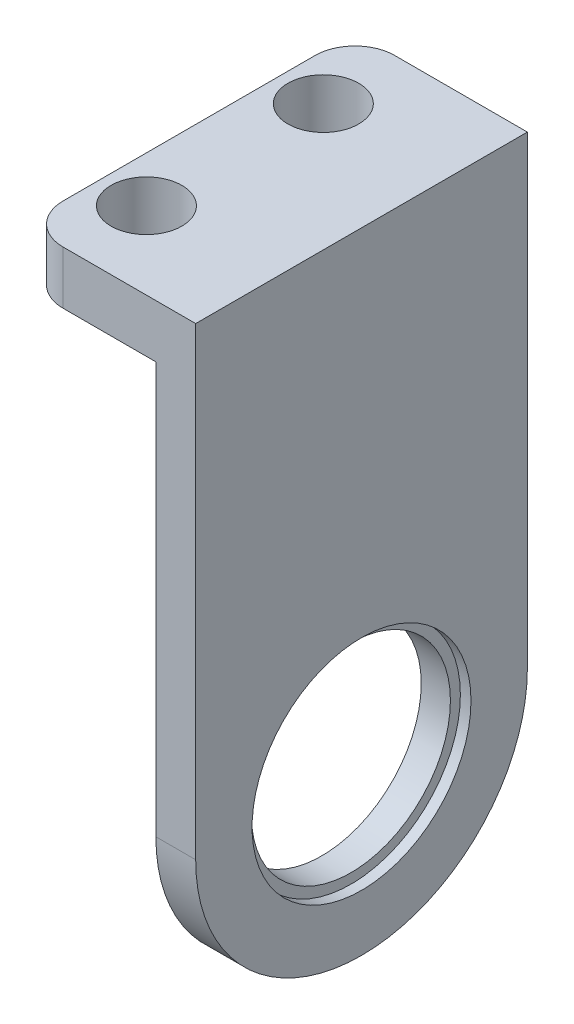
from build123d import *

# Parameters (mm, degrees)
SKETCH_1_R          = 7.5
EXTRUDE_1_DEPTH     = 3
SKETCH_2_W          = 25
SKETCH_2_H          = 4
EXTRUDE_2_DEPTH     = 10
FILLET_1_R          = 3
SKETCH_8_R          = 8.25
CUT_EXTRUDE_2_DEPTH = 0.8
SCALE_1_SCALE       = 0.6
SKETCH_3_R          = 1.6
CUT_EXTRUDE_3_DEPTH = 5


with BuildPart() as part:
    # 草图1 → 凸台-拉伸1 (new body)
    with BuildSketch(Plane(origin=(0, 0, 0), x_dir=(0, 0, -1), z_dir=(1, 0, 0))):
        with BuildLine():
            Line((-12.5, 0), (-12.5, 35))
            Line((-12.5, 35), (12.5, 35))
            Line((12.5, 35), (12.5, 0))
            ThreePointArc((12.5, 0), (0, -12.5), (-12.5, 0))
        make_face()
        Circle(SKETCH_1_R, mode=Mode.SUBTRACT)
    extrude(amount=EXTRUDE_1_DEPTH)

    # 草图2 → 凸台-拉伸2 (add)
    with BuildSketch(Plane.ZY):
        with Locations((0, 33)):
            Rectangle(SKETCH_2_W, SKETCH_2_H)
    extrude(amount=EXTRUDE_2_DEPTH)

    # 圆角1
    fillet_1_edges = [part.edges().sort_by_distance(p)[0] for p in [
        (-10, 33, 12.5),
        (-10, 33, -12.5),
    ]]
    fillet(fillet_1_edges, radius=FILLET_1_R)

    # 草图8 → 切除-拉伸2 (cut)
    with BuildSketch(Plane(origin=(3, 0, 0), x_dir=(0, 0, -1), z_dir=(1, 0, 0))):
        Circle(SKETCH_8_R)
    extrude(amount=-CUT_EXTRUDE_2_DEPTH, mode=Mode.SUBTRACT)


with BuildPart() as part_1:
    # 缩放比例1: scaled about (-0.181266262, 19.683257287, 0)
    add(part.part.scale(SCALE_1_SCALE).moved(Location((-0.072506505, 7.873302915, 0))))

    # 草图3 → 切除-拉伸3 (cut)
    with BuildSketch(Plane(origin=(0, 28.873302915, 0), x_dir=(1, 0, 0), z_dir=(0, 1, 0))):
        with Locations(Location((-4, 4, 0), (0, 0, 270))):
            Circle(SKETCH_3_R)
        with Locations(Location((-4, -4, 0), (0, 0, 270))):
            Circle(SKETCH_3_R)
    extrude(amount=-CUT_EXTRUDE_3_DEPTH, mode=Mode.SUBTRACT)


solid = part_1.part
